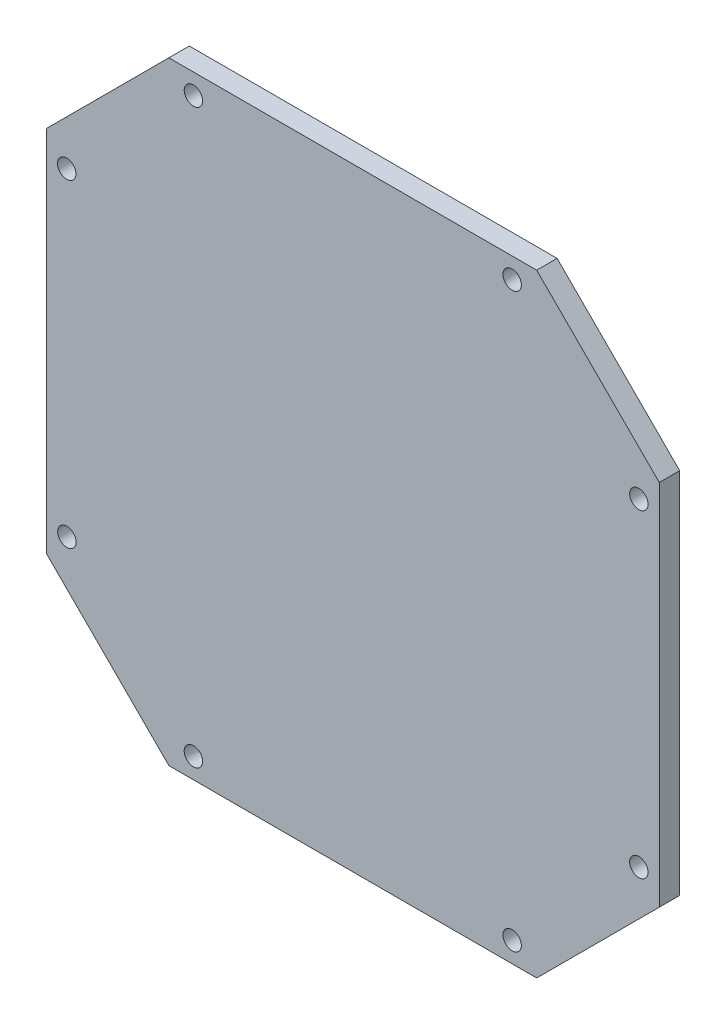
from build123d import *

# Parameters (mm, degrees)
BOSS_EXTRUDE1_DEPTH       = 10
F_1_0MM_DOWEL_HOLE1_D     = 9
F_1_0MM_DOWEL_HOLE1_DEPTH = 29.296127214
F_1_0MM_DOWEL_HOLE1_TIP   = 2.703872786


with BuildPart() as part:
    # Sketch1 → Boss-Extrude1 (new body)
    with BuildSketch(Plane.XY):
        Polygon((0, 0), (0, 180), (60, 240), (240, 240), (300, 180), (300, 0), (240, -60), (60, -60), align=None)
    extrude(amount=BOSS_EXTRUDE1_DEPTH)

    # Ø1.0mm Dowel Hole1
    with Locations(Plane(origin=(0, 0, 0), x_dir=(-1, 0, 0), z_dir=(0, 0, -1))):
        with Locations((-72, 230), (-228, 230), (-290, 168), (-290, 12), (-228, -50), (-72, -50), (-10.09572527, 12), (-10, 168)):
            Hole(F_1_0MM_DOWEL_HOLE1_D / 2, depth=F_1_0MM_DOWEL_HOLE1_DEPTH)
            with Locations((0, 0, -(F_1_0MM_DOWEL_HOLE1_DEPTH + F_1_0MM_DOWEL_HOLE1_TIP / 2))):  # 118° drill point
                Cone(0, F_1_0MM_DOWEL_HOLE1_D / 2, F_1_0MM_DOWEL_HOLE1_TIP, mode=Mode.SUBTRACT)


solid = part.part
